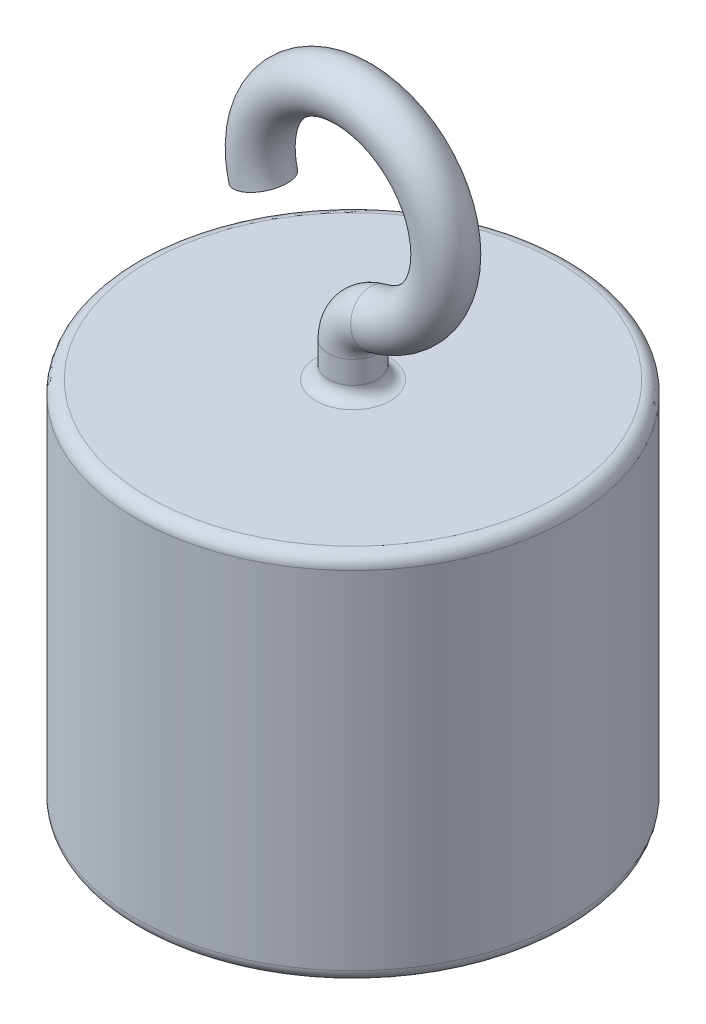
from build123d import *

# Parameters (mm, degrees)
SKETCH1_W   = 35
SKETCH1_H   = 60
FILLET1_R   = 2
SKETCH3_R   = 4
FILLET2_R   = 2
SKETCH4_W   = 20
SKETCH4_H   = 6
SKETCH4_W_2 = 3
SKETCH4_H_2 = 4


with BuildPart() as part:
    # Sketch1 → Revolve1 (revolve)
    with BuildSketch(Plane.XY, mode=Mode.PRIVATE) as revolve1_sk:
        with Locations((17.5, 0)):
            Rectangle(SKETCH1_W, SKETCH1_H)
    revolve(revolve1_sk.sketch.rotate(Axis((0, 30, 0), (0, -1, 0)), 180), axis=Axis((0, 30, 0), (0, -1, 0)))

    # Fillet1
    fillet1_edges = [part.edges().sort_by_distance(p)[0] for p in [
        (35, -30, 0),
        (35, 30, 0),
    ]]
    fillet(fillet1_edges, radius=FILLET1_R)

    # Sweep1: sweep along a path in Sketch2
    with BuildLine(Plane.XY) as sweep1_path:
        Line((0, 30), (0, 35.635083269))
        ThreePointArc((0, 35.635083269), (1.047152925, 38.696945447), (3.75, 40.476312452))
        ThreePointArc((3.75, 40.476312452), (7.559152338, 67.956049395), (-14.488887394, 51.117714323))
    # Sketch3 → Sweep1 (sweep)
    with BuildSketch(Plane(origin=(0, 30, 0), x_dir=(1, 0, 0), z_dir=(0, 1, 0))):
        Circle(SKETCH3_R)
    sweep(path=sweep1_path.line)

    # Fillet2
    fillet2_edges = [part.edges().sort_by_distance(p)[0] for p in [
        (-4, 30, 0),
    ]]
    fillet(fillet2_edges, radius=FILLET2_R)

    # Sketch4 → Cut-Revolve1 (revolve, cut)
    with BuildSketch(Plane(origin=(0, 0, 0), x_dir=(0, 0, -1), z_dir=(1, 0, 0)), mode=Mode.PRIVATE) as cut_revolve1_sk:
        with Locations((-10, -27)):
            Rectangle(SKETCH4_W, SKETCH4_H)
        with Locations((-1.5, -22)):
            Rectangle(SKETCH4_W_2, SKETCH4_H_2)
    revolve(cut_revolve1_sk.sketch.rotate(Axis((0, -30, 0), (0, 1, 0)), 90), axis=Axis((0, -30, 0), (0, 1, 0)), mode=Mode.SUBTRACT)


solid = part.part
